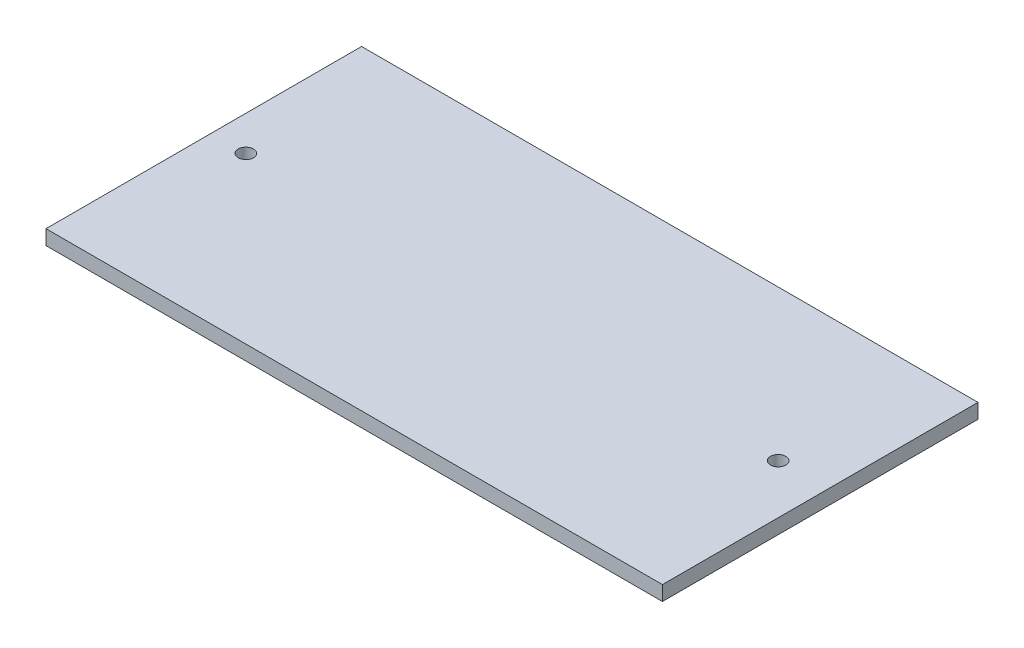
from build123d import *

# Parameters (mm, degrees)
SKETCH1_W           = 133.175
SKETCH1_H           = 68.175
SKETCH1_R           = 1.65
BOSS_EXTRUDE1_DEPTH = 3.175


with BuildPart() as part:
    # Sketch1 → Boss-Extrude1 (new body)
    with BuildSketch(Plane(origin=(0, 0, 0), x_dir=(1, 0, 0), z_dir=(0, 1, 0))):
        Rectangle(SKETCH1_W, SKETCH1_H)
        with Locations(Location((-59.0875, 1.5875, 0), (0, 0, 270))):
            Circle(SKETCH1_R, mode=Mode.SUBTRACT)
        with Locations(Location((55.9125, 1.5875, 0), (0, 0, 270))):
            Circle(SKETCH1_R, mode=Mode.SUBTRACT)
    extrude(amount=BOSS_EXTRUDE1_DEPTH)


solid = part.part
